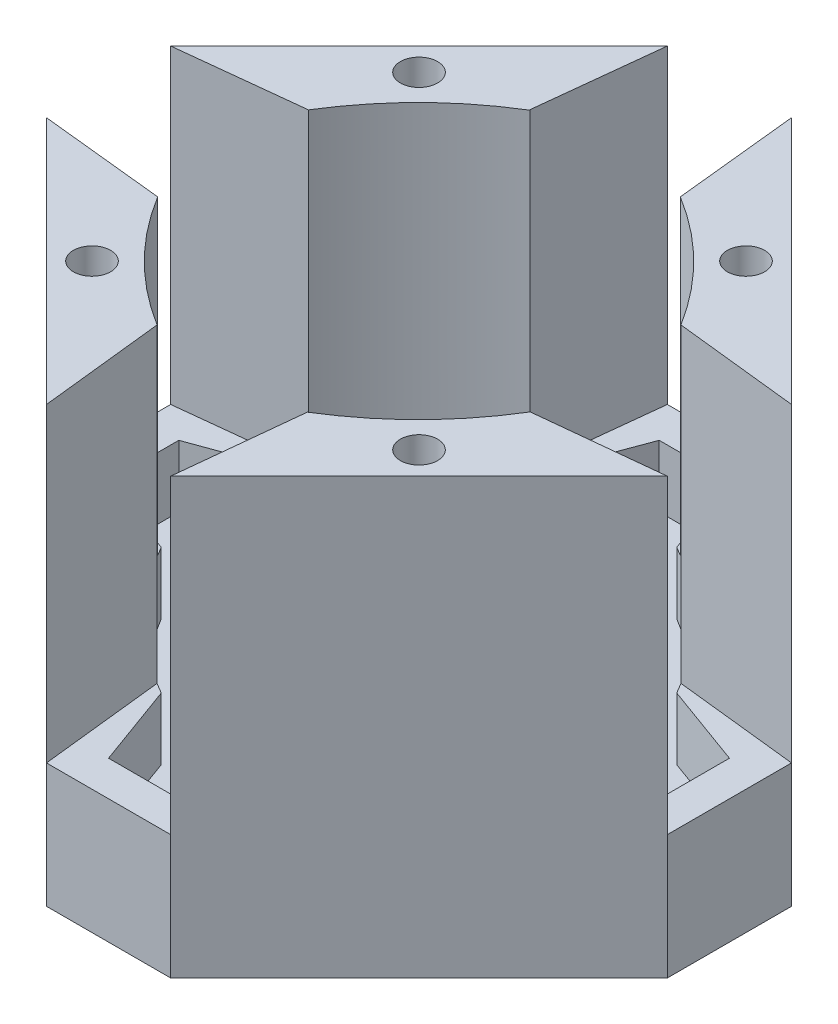
from build123d import *

# Parameters (mm, degrees)
SKETCH1_W           = 50
SKETCH1_H           = 50
SKETCH1_R           = 4.5
BOSS_EXTRUDE1_DEPTH = 5
SKETCH2_R           = 2
CUT_EXTRUDE1_DEPTH  = 36.707142143
BOSS_EXTRUDE2_DEPTH = 30
BOSS_EXTRUDE3_DEPTH = 30
CUT_EXTRUDE5_DEPTH  = 25
SKETCH9_R           = 2.5
CUT_EXTRUDE8_DEPTH  = 47.36809265
SKETCH10_R          = 1.5
CUT_EXTRUDE9_DEPTH  = 10


with BuildPart() as part:
    # Sketch1 → Boss-Extrude1 (new body)
    with BuildSketch(Plane(origin=(0, 0, 0), x_dir=(1, 0, 0), z_dir=(0, 1, 0))):
        Rectangle(SKETCH1_W, SKETCH1_H)
        with Locations(Location((0, 0, 0), (0, 0, 270))):
            Circle(SKETCH1_R, mode=Mode.SUBTRACT)
    extrude(amount=BOSS_EXTRUDE1_DEPTH)

    # Sketch2 → Cut-Extrude1 (cut, through all)
    with BuildSketch(Plane(origin=(0, 5, 0), x_dir=(1, 0, 0), z_dir=(0, 1, 0))):
        with Locations(Location((-0.058911488, 16.249893213, 0), (0, 0, 270))):
            Circle(SKETCH2_R)
        with Locations(Location((16.249893213, -0.058911488, 0), (0, 0, 90))):
            Circle(SKETCH2_R)
        with Locations(Location((0.058911488, -16.249893213, 0), (0, 0, 270))):
            Circle(SKETCH2_R)
        with Locations(Location((-16.249893213, 0.058911488, 0), (0, 0, 90))):
            Circle(SKETCH2_R)
        Polygon((-25, 25), (-25, 5), (-5, 25), align=None)
        Polygon((25, -25), (5, -25), (25, -5), align=None)
        Polygon((-25, -25), (-25, -5), (-5, -25), align=None)
        Polygon((25, 25), (25, 5), (5, 25), align=None)
    extrude(amount=-CUT_EXTRUDE1_DEPTH, mode=Mode.SUBTRACT)

    # Sketch3 → Boss-Extrude2 (add)
    with BuildSketch(Plane(origin=(0, 5, 0), x_dir=(1, 0, 0), z_dir=(0, 1, 0))):
        Polygon((-5, 25), (-7.828427125, 22.171572875), (-22.171572875, 7.828427125), (-25, 5), (-25, -5), (-22.171572875, -7.828427125), (-5, -25), (0, -25), (5, -25), (7.828427125, -22.171572875), (22.171572875, -7.828427125), (25, -5), (25, 5), (7.828427125, 22.171572875), (5, 25), align=None)
        Polygon((-2.828427125, -22.171572875), (-22.171572875, -2.828427125), (-22.171572875, 2.828427125), (-2.828427125, 22.171572875), (2.828427125, 22.171572875), (22.171572875, 2.828427125), (22.171572875, -2.828427125), (2.828427125, -22.171572875), align=None, mode=Mode.SUBTRACT)
    extrude(amount=BOSS_EXTRUDE2_DEPTH)

    # Sketch4 → Boss-Extrude3 (add)
    with BuildSketch(Plane(origin=(0, 35, 0), x_dir=(1, 0, 0), z_dir=(0, 1, 0))):
        with BuildLine():
            add(Edge.make_bspline(
                [(-5.341714296, 15.415645017), (-9.777866181, 12.873181646), (-13.108736095, 9.402087486), (-15.504012831, 5.253346482)],
                knots=[0, 0, 0, 0, 1, 1, 1, 1], degree=3))
            Line((-15.504012831, 5.253346482), (-22.171572875, 2.828427125))
            Line((-22.171572875, 2.828427125), (-2.828427125, 22.171572875))
            Line((-2.828427125, 22.171572875), (-5.341714296, 15.415645017))
        make_face()
        with BuildLine():
            Line((5.341714296, 15.415645017), (2.828427125, 22.171572875))
            Line((2.828427125, 22.171572875), (22.171572875, 2.828427125))
            Line((22.171572875, 2.828427125), (15.504012831, 5.253346482))
            add(Edge.make_bspline(
                [(5.341714296, 15.415645017), (9.777866181, 12.873181646), (13.108736095, 9.402087486), (15.504012831, 5.253346482)],
                knots=[0, 0, 0, 0, 1, 1, 1, 1], degree=3))
        make_face()
        with BuildLine():
            Line((15.415645017, -5.341714296), (22.171572875, -2.828427125))
            Line((22.171572875, -2.828427125), (2.828427125, -22.171572875))
            Line((2.828427125, -22.171572875), (5.253346482, -15.504012831))
            add(Edge.make_bspline(
                [(15.415645017, -5.341714296), (12.873181646, -9.777866181), (9.402087486, -13.108736095), (5.253346482, -15.504012831)],
                knots=[0, 0, 0, 0, 1, 1, 1, 1], degree=3))
        make_face()
        with BuildLine():
            add(Edge.make_bspline(
                [(-15.415645017, -5.341714296), (-12.873181646, -9.777866181), (-9.402087486, -13.108736095), (-5.253346482, -15.504012831)],
                knots=[0, 0, 0, 0, 1, 1, 1, 1], degree=3))
            Line((-5.253346482, -15.504012831), (-2.828427125, -22.171572875))
            Line((-2.828427125, -22.171572875), (-22.171572875, -2.828427125))
            Line((-22.171572875, -2.828427125), (-15.415645017, -5.341714296))
        make_face()
    extrude(amount=-BOSS_EXTRUDE3_DEPTH)

    # Sketch7 → Cut-Extrude5 (cut)
    with BuildSketch(Plane(origin=(0, 35, 0), x_dir=(1, 0, 0), z_dir=(0, 1, 0))):
        Polygon((-25, 5), (-25, -5), (-14.999999986, -6.043670064), (-14.999999986, 6.093977805), align=None)
        Polygon((25, -5), (14.999999986, -6.043670064), (14.999999986, 6.093977805), (25, 5), align=None)
        Polygon((-5, -25), (5, -25), (6.043670064, -14.999999986), (-6.093977805, -14.999999986), align=None)
        Polygon((5, 25), (6.043670064, 14.999999986), (-6.093977805, 14.999999986), (-5, 25), align=None)
    extrude(amount=-CUT_EXTRUDE5_DEPTH, mode=Mode.SUBTRACT)

    # Sketch9 → Cut-Extrude8 (cut, through all)
    with BuildSketch(Plane(origin=(0, 5, 0), x_dir=(1, 0, 0), z_dir=(0, 1, 0))):
        with Locations(Location((0, 9.499893213, 0), (0, 0, 270))):
            Circle(SKETCH9_R)
        with Locations(Location((0, -9.499893213, 0), (0, 0, 90))):
            Circle(SKETCH9_R)
        with Locations(Location((9.499893213, 0, 0), (0, 0, 270))):
            Circle(SKETCH9_R)
        with Locations(Location((-9.499893213, 0, 0), (0, 0, 90))):
            Circle(SKETCH9_R)
    extrude(amount=-CUT_EXTRUDE8_DEPTH, mode=Mode.SUBTRACT)

    # Sketch10 → Cut-Extrude9 (cut)
    with BuildSketch(Plane(origin=(0, 35, 0), x_dir=(1, 0, 0), z_dir=(0, 1, 0))):
        with Locations(Location((13.166804189, 13.166804189, 0), (0, 0, 270))):
            Circle(SKETCH10_R)
        with Locations(Location((-13.166804189, 13.166804189, 0), (0, 0, 90))):
            Circle(SKETCH10_R)
        with Locations(Location((-13.166804189, -13.166804189, 0), (0, 0, 270))):
            Circle(SKETCH10_R)
        with Locations(Location((13.166804189, -13.166804189, 0), (0, 0, 90))):
            Circle(SKETCH10_R)
    extrude(amount=-CUT_EXTRUDE9_DEPTH, mode=Mode.SUBTRACT)


solid = part.part
